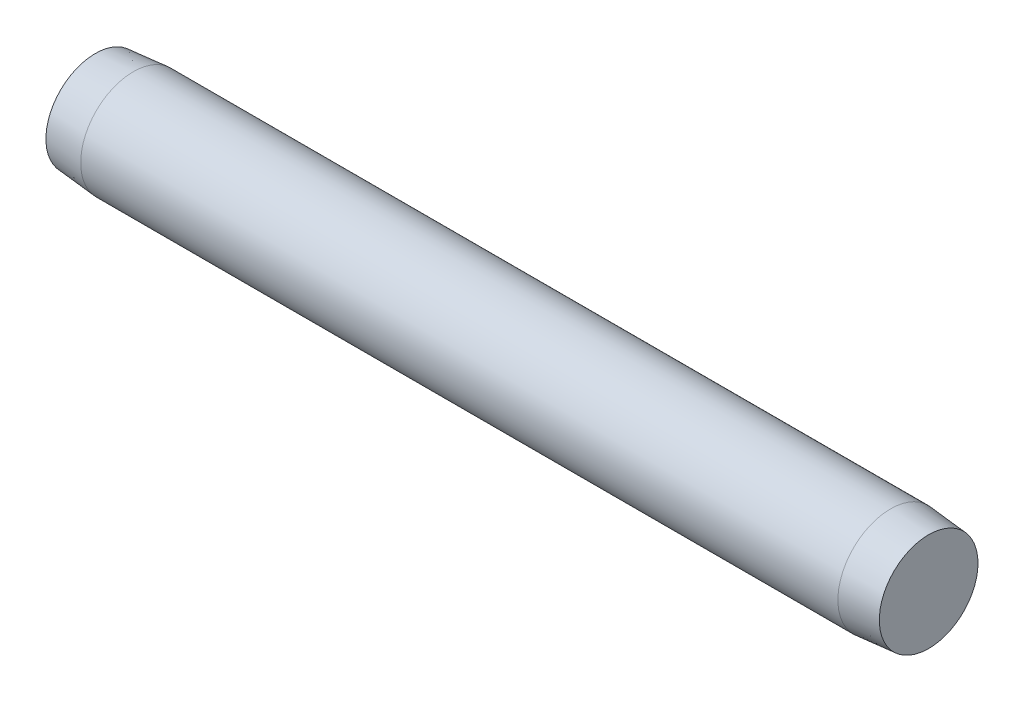
from build123d import *

# Parameters (mm, degrees)
SKETCH1_R           = 1.58
BOSS_EXTRUDE1_DEPTH = 25
CHAMFER1_SIZE       = 0.1
CHAMFER1_SIZE2      = 1.14300523
CHAMFER2_SIZE       = 0.1
CHAMFER2_SIZE2      = 1.14300523


with BuildPart() as part:
    # Sketch1 → Boss-Extrude1 (new body)
    with BuildSketch(Plane(origin=(0, 0, 0), x_dir=(0, 0, -1), z_dir=(1, 0, 0))):
        Circle(SKETCH1_R)
    extrude(amount=BOSS_EXTRUDE1_DEPTH)

    # Chamfer1
    chamfer1_edges = [part.edges().sort_by_distance(p)[0] for p in [
        (0, 0, 1.58),
    ]]
    chamfer1_side = [part.faces().sort_by_distance(p)[0] for p in [
        (0, 0, 0),
    ]]
    chamfer(chamfer1_edges, length=CHAMFER1_SIZE, length2=CHAMFER1_SIZE2, reference=chamfer1_side[0])

    # Chamfer2
    chamfer2_edges = [part.edges().sort_by_distance(p)[0] for p in [
        (25, 0, 1.58),
    ]]
    chamfer2_side = [part.faces().sort_by_distance(p)[0] for p in [
        (25, 0, 0),
    ]]
    chamfer(chamfer2_edges, length=CHAMFER2_SIZE, length2=CHAMFER2_SIZE2, reference=chamfer2_side[0])


solid = part.part
